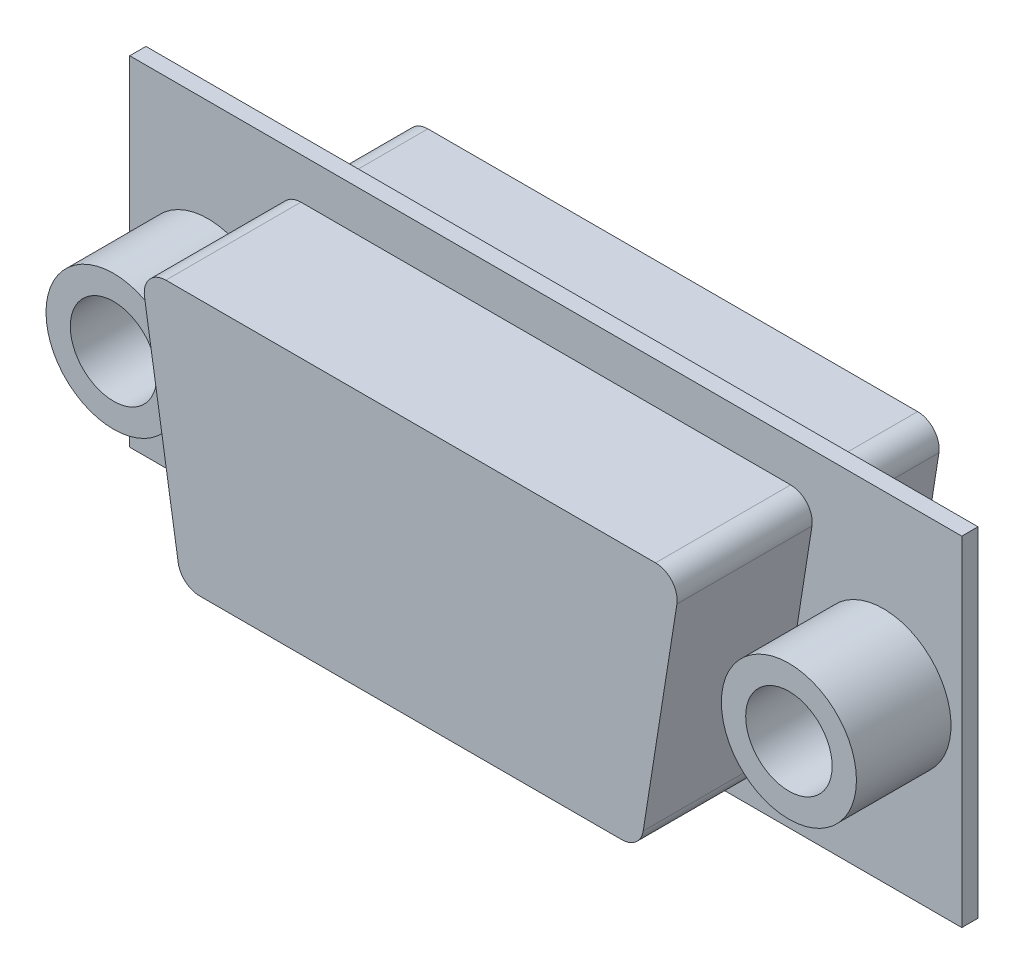
from build123d import *

# Parameters (mm, degrees)
F3_01_CONTINUOUSSOCKETBODY_D9_70_DEPTH     = 9.7
SKETCH_2_W                                 = 30.8
SKETCH_2_H                                 = 12.55
F3_02_FLANGEBLANK_TOZ4_70_DEPTH            = 4.7
SKETCH_3_R                                 = 2.5
F3_03_FIXEDPOSTBLANK_TOZ8_20_DEPTH         = 8.2
SKETCH_4_W                                 = 30.8
SKETCH_4_H                                 = 12.55
F3_04_FRONTRELIEF_TOZ4_10_DEPTH            = 4.1
F3_05_RESTOREPROTRUDINGSOCKETNOSE_DEPTH    = 4.2
F3_06_DRECEIVEROUTERPOCKET_D4_10_DEPTH     = 4.1
F3_07_DRECEIVERINNERISLAND_DEPTH           = 4.2
SKETCH_8_R                                 = 0.575
F3_08_9CONTACTHOLES_DIA1_15_D4_50_DEPTH    = 4.5
SKETCH_9_R                                 = 0.675
F3_09_EQUIVALENTLEADIN_DIA1_35_D0_25_DEPTH = 0.25
SKETCH_10_R                                = 1.6
F3_10_FIXEDPOSTBORES_DIA3_20_DEPTH         = 8.3


with BuildPart() as part:
    # 草图1 → F3_01_ContinuousSocketBody_D9.70 (new body)
    with BuildSketch(Plane.XY):
        with BuildLine():
            Line((-9.063773303, 4.75), (9.063773303, 4.75))
            ThreePointArc((9.063773303, 4.75), (9.671973947, 4.469703739), (9.853983675, 3.825229941))
            Line((9.853983675, 3.825229941), (8.606615254, -4.074770059))
            ThreePointArc((8.606615254, -4.074770059), (8.336108621, -4.558200644), (7.816404882, -4.75))
            Line((7.816404882, -4.75), (-7.816404882, -4.75))
            ThreePointArc((-7.816404882, -4.75), (-8.336108621, -4.558200644), (-8.606615254, -4.074770059))
            Line((-8.606615254, -4.074770059), (-9.853983675, 3.825229941))
            ThreePointArc((-9.853983675, 3.825229941), (-9.671973947, 4.469703739), (-9.063773303, 4.75))
        make_face()
    extrude(amount=F3_01_CONTINUOUSSOCKETBODY_D9_70_DEPTH)

    # 草图2 → F3_02_FlangeBlank_ToZ4.70 (add)
    with BuildSketch(Plane.XY):
        Rectangle(SKETCH_2_W, SKETCH_2_H)
    extrude(amount=F3_02_FLANGEBLANK_TOZ4_70_DEPTH)

    # 草图3 → F3_03_FixedPostBlank_ToZ8.20 (add)
    with BuildSketch(Plane.XY):
        with Locations(Location((-12.5, 0, 0), (0, 0, 180))):
            Circle(SKETCH_3_R)
        with Locations(Location((12.5, 0, 0), (0, 0, 180))):
            Circle(SKETCH_3_R)
    extrude(amount=F3_03_FIXEDPOSTBLANK_TOZ8_20_DEPTH)

    # 草图4 → F3_04_FrontRelief_ToZ4.10 (cut)
    with BuildSketch(Plane.XY):
        Rectangle(SKETCH_4_W, SKETCH_4_H)
    extrude(amount=F3_04_FRONTRELIEF_TOZ4_10_DEPTH, mode=Mode.SUBTRACT)

    # 草图5 → F3_05_RestoreProtrudingSocketNose (add)
    with BuildSketch(Plane.XY):
        with BuildLine():
            Line((-9.063773303, 4.75), (9.063773303, 4.75))
            ThreePointArc((9.063773303, 4.75), (9.671973947, 4.469703739), (9.853983675, 3.825229941))
            Line((9.853983675, 3.825229941), (8.606615254, -4.074770059))
            ThreePointArc((8.606615254, -4.074770059), (8.336108621, -4.558200644), (7.816404882, -4.75))
            Line((7.816404882, -4.75), (-7.816404882, -4.75))
            ThreePointArc((-7.816404882, -4.75), (-8.336108621, -4.558200644), (-8.606615254, -4.074770059))
            Line((-8.606615254, -4.074770059), (-9.853983675, 3.825229941))
            ThreePointArc((-9.853983675, 3.825229941), (-9.671973947, 4.469703739), (-9.063773303, 4.75))
        make_face()
    extrude(amount=F3_05_RESTOREPROTRUDINGSOCKETNOSE_DEPTH)

    # 草图6 → F3_06_DReceiverOuterPocket_D4.10 (cut)
    with BuildSketch(Plane.XY):
        with BuildLine():
            Line((-7.444046944, 4.3), (7.444046944, 4.3))
            ThreePointArc((7.444046944, 4.3), (8.154188345, 3.952900706), (8.316575127, 3.179331535))
            Line((8.316575127, 3.179331535), (6.596807685, -3.620668465))
            ThreePointArc((6.596807685, -3.620668465), (6.277180209, -4.110141401), (5.724279503, -4.3))
            Line((5.724279503, -4.3), (-5.724279503, -4.3))
            ThreePointArc((-5.724279503, -4.3), (-6.277180209, -4.110141401), (-6.596807685, -3.620668465))
            Line((-6.596807685, -3.620668465), (-8.316575127, 3.179331535))
            ThreePointArc((-8.316575127, 3.179331535), (-8.154188345, 3.952900706), (-7.444046944, 4.3))
        make_face()
    extrude(amount=F3_06_DRECEIVEROUTERPOCKET_D4_10_DEPTH, mode=Mode.SUBTRACT)

    # 草图7 → F3_07_DReceiverInnerIsland (add)
    with BuildSketch(Plane.XY):
        with BuildLine():
            Line((-7.047021477, 3.3), (7.047021477, 3.3))
            ThreePointArc((7.047021477, 3.3), (7.371118761, 3.13443752), (7.426924294, 2.774804754))
            Line((7.426924294, 2.774804754), (5.515560657, -3.025195246))
            ThreePointArc((5.515560657, -3.025195246), (5.37009536, -3.224097284), (5.135657841, -3.3))
            Line((5.135657841, -3.3), (-5.135657841, -3.3))
            ThreePointArc((-5.135657841, -3.3), (-5.37009536, -3.224097284), (-5.515560657, -3.025195246))
            Line((-5.515560657, -3.025195246), (-7.426924294, 2.774804754))
            ThreePointArc((-7.426924294, 2.774804754), (-7.371118761, 3.13443752), (-7.047021477, 3.3))
        make_face()
    extrude(amount=F3_07_DRECEIVERINNERISLAND_DEPTH)

    # 草图8 → F3_08_9ContactHoles_Dia1.15_D4.50 (cut)
    with BuildSketch(Plane.XY):
        with Locations((-5.54, 1.42)):
            Circle(SKETCH_8_R)
        with Locations((-2.77, 1.42)):
            Circle(SKETCH_8_R)
        with Locations((0, 1.42)):
            Circle(SKETCH_8_R)
        with Locations((2.77, 1.42)):
            Circle(SKETCH_8_R)
        with Locations((5.54, 1.42)):
            Circle(SKETCH_8_R)
        with Locations((-4.155, -1.42)):
            Circle(SKETCH_8_R)
        with Locations((-1.385, -1.42)):
            Circle(SKETCH_8_R)
        with Locations((1.385, -1.42)):
            Circle(SKETCH_8_R)
        with Locations((4.155, -1.42)):
            Circle(SKETCH_8_R)
    extrude(amount=F3_08_9CONTACTHOLES_DIA1_15_D4_50_DEPTH, mode=Mode.SUBTRACT)

    # 草图9 → F3_09_EquivalentLeadIn_Dia1.35_D0.25 (cut)
    with BuildSketch(Plane.XY):
        with Locations((-5.54, 1.42)):
            Circle(SKETCH_9_R)
        with Locations((-2.77, 1.42)):
            Circle(SKETCH_9_R)
        with Locations((0, 1.42)):
            Circle(SKETCH_9_R)
        with Locations((2.77, 1.42)):
            Circle(SKETCH_9_R)
        with Locations((5.54, 1.42)):
            Circle(SKETCH_9_R)
        with Locations((-4.155, -1.42)):
            Circle(SKETCH_9_R)
        with Locations((-1.385, -1.42)):
            Circle(SKETCH_9_R)
        with Locations((1.385, -1.42)):
            Circle(SKETCH_9_R)
        with Locations((4.155, -1.42)):
            Circle(SKETCH_9_R)
    extrude(amount=F3_09_EQUIVALENTLEADIN_DIA1_35_D0_25_DEPTH, mode=Mode.SUBTRACT)

    # 草图10 → F3_10_FixedPostBores_Dia3.20 (cut)
    with BuildSketch(Plane.XY):
        with Locations(Location((-12.5, 0, 0), (0, 0, 180))):
            Circle(SKETCH_10_R)
        with Locations(Location((12.5, 0, 0), (0, 0, 180))):
            Circle(SKETCH_10_R)
    extrude(amount=F3_10_FIXEDPOSTBORES_DIA3_20_DEPTH, mode=Mode.SUBTRACT)


solid = part.part
